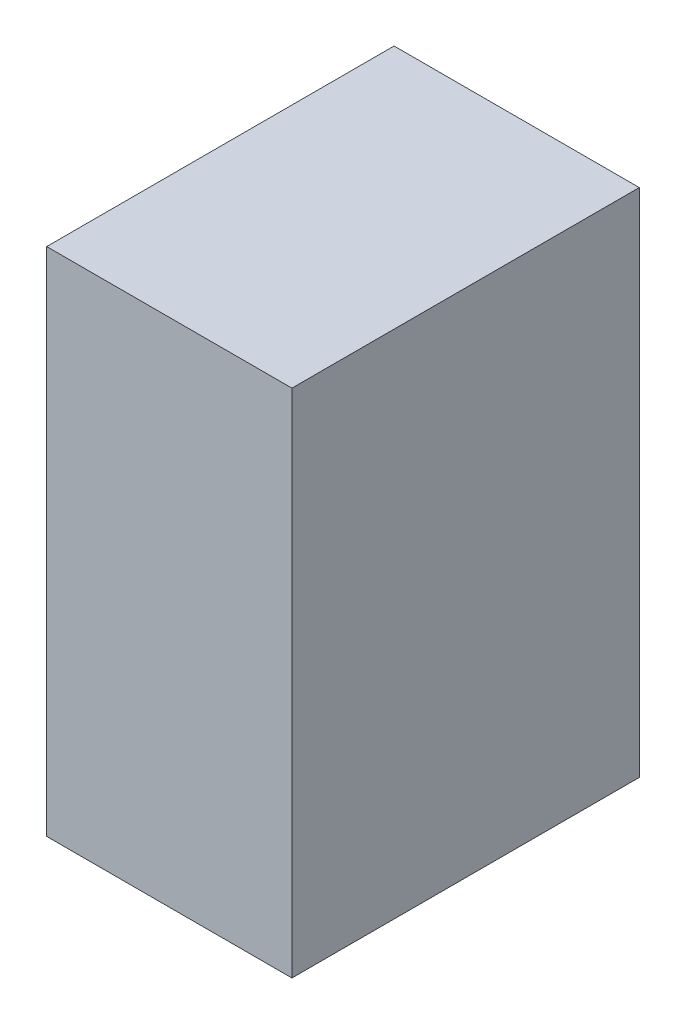
from build123d import *

# Parameters (mm, degrees)
ESQUISSE1_W        = 36
ESQUISSE1_H        = 75
BOSS_EXTRU_1_DEPTH = 25.5


with BuildPart() as part:
    # Esquisse1 → Boss.-Extru.1 (new, symmetric)
    with BuildSketch(Plane.XY):
        Rectangle(ESQUISSE1_W, ESQUISSE1_H)
    extrude(amount=BOSS_EXTRU_1_DEPTH, both=True)


solid = part.part
